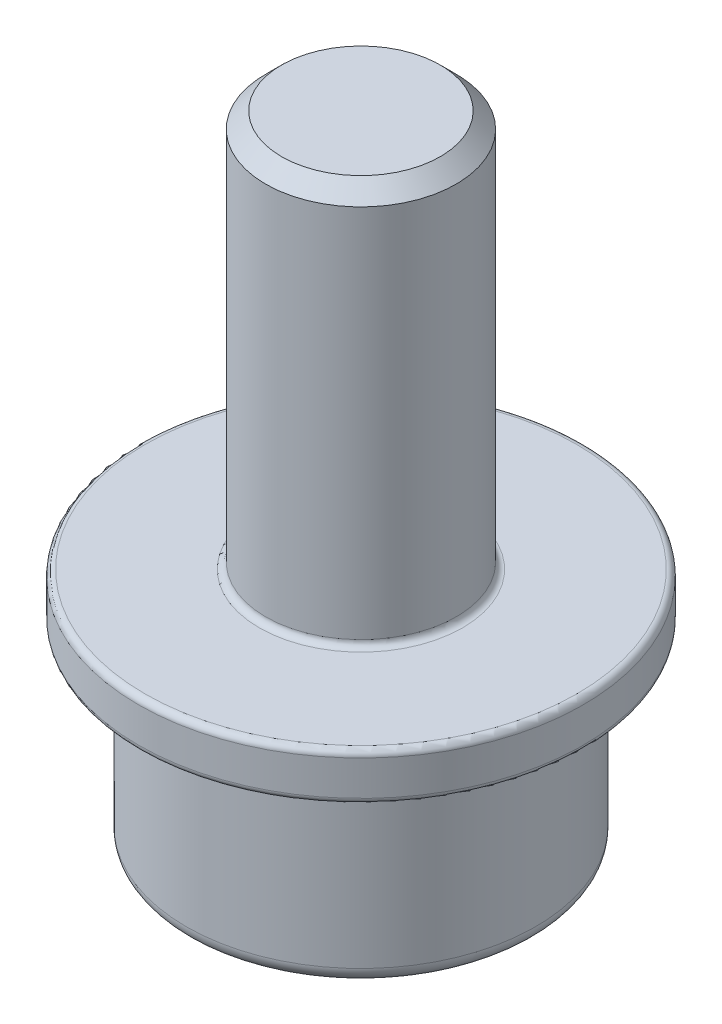
from build123d import *

# Parameters (mm, degrees)
SKETCH1_R           = 2.75
BOSS_EXTRUDE1_DEPTH = 3
SKETCH2_R           = 1.5
BOSS_EXTRUDE2_DEPTH = 7
CUT_EXTRUDE1_DEPTH  = 1.5
CHAMFER1_SIZE       = 0.25
FILLET1_R           = 0.25
CHAMFER2_SIZE       = 0.25
FILLET2_R           = 0.1
SKETCH4_R           = 3.5
SKETCH4_R_2         = 1.5
BOSS_EXTRUDE3_DEPTH = 0.75
FILLET3_R           = 0.1


with BuildPart() as part:
    # Sketch1 → Boss-Extrude1 (new body)
    with BuildSketch(Plane(origin=(0, 0, 0), x_dir=(1, 0, 0), z_dir=(0, 1, 0))):
        with Locations(Location((0, 0, 0), (0, 0, 270))):
            Circle(SKETCH1_R)
    extrude(amount=BOSS_EXTRUDE1_DEPTH)

    # Sketch2 → Boss-Extrude2 (add)
    with BuildSketch(Plane(origin=(0, 3, 0), x_dir=(1, 0, 0), z_dir=(0, 1, 0))):
        with Locations(Location((0, 0, 0), (0, 0, 270))):
            Circle(SKETCH2_R)
    extrude(amount=BOSS_EXTRUDE2_DEPTH)

    # Sketch3 → Cut-Extrude1 (cut)
    with BuildSketch(Plane.XZ):
        Polygon((0.934168857, 0.974591477), (-0.376936549, 1.2963097), (-1.311105406, 0.321718223), (-0.934168857, -0.974591477), (0.376936549, -1.2963097), (1.311105406, -0.321718223), align=None)
    extrude(amount=-CUT_EXTRUDE1_DEPTH, mode=Mode.SUBTRACT)

    # Chamfer1
    chamfer1_edges = [part.edges().sort_by_distance(p)[0] for p in [
        (1.122637131, 0, 0.326436627),
        (0.278616154, 0, 1.135450588),
        (-0.844020977, 0, 0.809013962),
        (-1.122637131, 0, -0.326436627),
        (-0.278616154, 0, -1.135450588),
        (0.844020977, 0, -0.809013962),
    ]]
    chamfer(chamfer1_edges, length=CHAMFER1_SIZE)

    # Fillet1
    fillet1_edges = [part.edges().sort_by_distance(p)[0] for p in [
        (0, 0, -2.75),
    ]]
    fillet(fillet1_edges, radius=FILLET1_R)

    # Chamfer2
    chamfer2_edges = [part.edges().sort_by_distance(p)[0] for p in [
        (0, 10, -1.5),
    ]]
    chamfer(chamfer2_edges, length=CHAMFER2_SIZE)

    # Fillet2
    fillet2_edges = [part.edges().sort_by_distance(p)[0] for p in [
        (0, 3, -2.75),
    ]]
    fillet(fillet2_edges, radius=FILLET2_R)

    # Sketch4 → Boss-Extrude3 (add)
    with BuildSketch(Plane(origin=(0, 3, 0), x_dir=(1, 0, 0), z_dir=(0, 1, 0))):
        with Locations(Location((0, 0, 0), (0, 0, 270))):
            Circle(SKETCH4_R)
        with Locations(Location((0, 0, 0), (0, 0, 270))):
            Circle(SKETCH4_R_2, mode=Mode.SUBTRACT)
    extrude(amount=BOSS_EXTRUDE3_DEPTH)

    # Fillet3
    fillet3_edges = [part.edges().sort_by_distance(p)[0] for p in [
        (0, 3.75, -3.5),
        (0, 3, -3.5),
        (0, 3.75, -1.5),
    ]]
    fillet(fillet3_edges, radius=FILLET3_R)


solid = part.part
